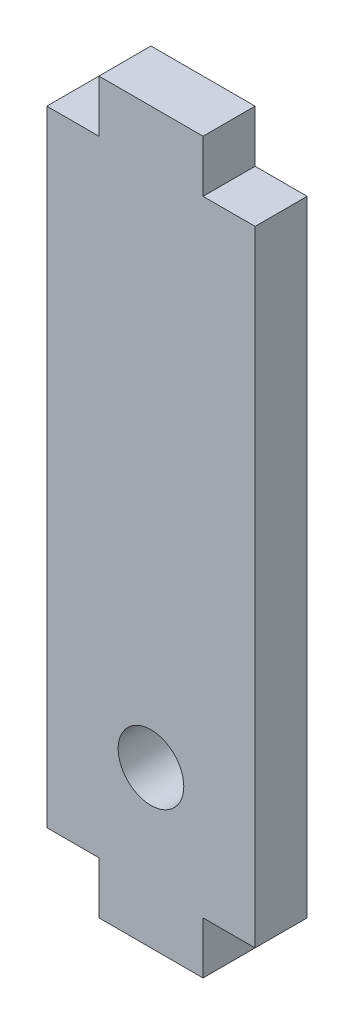
from build123d import *

# Parameters (mm, degrees)
SKETCH1_W           = 25.4
SKETCH1_H           = 76.2
SKETCH1_W_2         = 12.7
SKETCH1_H_2         = 6.35
BOSS_EXTRUDE1_DEPTH = 6.35
SKETCH2_R           = 4
CUT_EXTRUDE1_DEPTH  = 47.6627796


with BuildPart() as part:
    # Sketch1 → Boss-Extrude1 (new body)
    with BuildSketch(Plane.XY):
        Rectangle(SKETCH1_W, SKETCH1_H)
        with Locations((0, -41.275)):
            Rectangle(SKETCH1_W_2, SKETCH1_H_2)
        with Locations((0, 41.275)):
            Rectangle(SKETCH1_W_2, SKETCH1_H_2)
    extrude(amount=BOSS_EXTRUDE1_DEPTH)

    # Sketch2 → Cut-Extrude1 (cut, through all)
    with BuildSketch(Plane.XY.offset(6.35)):
        with Locations((0, -25.4)):
            Circle(SKETCH2_R)
    extrude(amount=-CUT_EXTRUDE1_DEPTH, mode=Mode.SUBTRACT)


solid = part.part
